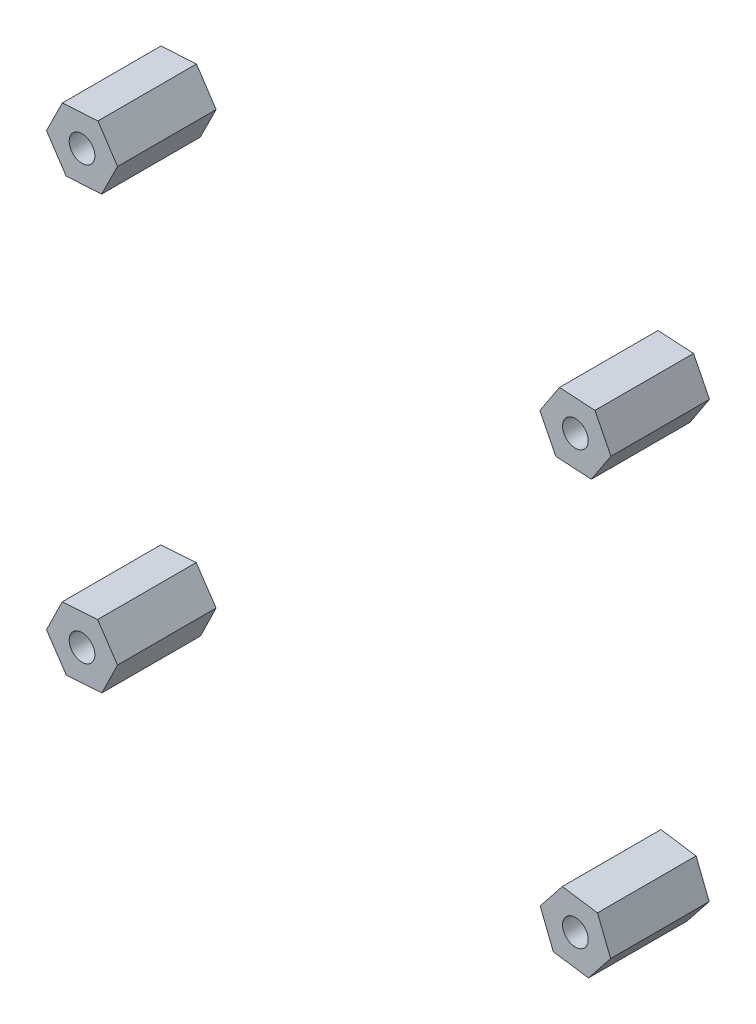
from build123d import *

# Parameters (mm, degrees)
SKETCH1_R             = 1.25
BOSS_EXTRUDE1_DEPTH   = 9.6
BOSS_EXTRUDE1_2_DEPTH = 9.6
BOSS_EXTRUDE1_3_DEPTH = 9.6
BOSS_EXTRUDE1_4_DEPTH = 9.6


with BuildPart() as part:
    # Sketch1 → Boss-Extrude1 (new body)
    with BuildSketch(Plane.XY):
        Polygon((-204.773374991, 103.579956463), (-203.227897726, 106.680198392), (-205.140047362, 109.56874193), (-208.597674263, 109.357043538), (-210.143151529, 106.256801608), (-208.231001893, 103.368258071), align=None)
        with Locations((-206.685524627, 106.4685)):
            Circle(SKETCH1_R, mode=Mode.SUBTRACT)
    extrude(amount=BOSS_EXTRUDE1_DEPTH)


with BuildPart() as body_2:
    # Sketch1 → Boss-Extrude1 2 (new body)
    with BuildSketch(Plane.XY):
        Polygon((-157.093384884, 103.371588278), (-155.187450531, 106.264236587), (-156.739590274, 109.36114831), (-160.197664371, 109.565411723), (-162.103598724, 106.672763414), (-160.551458981, 103.575851691), align=None)
        with Locations((-158.645524627, 106.4685)):
            Circle(SKETCH1_R, mode=Mode.SUBTRACT)
    extrude(amount=BOSS_EXTRUDE1_2_DEPTH)


with BuildPart() as body_3:
    # Sketch1 → Boss-Extrude1 3 (new body)
    with BuildSketch(Plane.XY):
        Polygon((-204.748368835, 61.526666538), (-203.229865997, 64.640209397), (-205.16702179, 67.512042859), (-208.62268042, 67.270333463), (-210.141183257, 64.156790604), (-208.204027465, 61.284957142), align=None)
        with Locations((-206.685524627, 64.3985)):
            Circle(SKETCH1_R, mode=Mode.SUBTRACT)
    extrude(amount=BOSS_EXTRUDE1_3_DEPTH)


with BuildPart() as body_4:
    # Sketch1 → Boss-Extrude1 4 (new body)
    with BuildSketch(Plane.XY):
        Polygon((-157.372499469, 61.176791301), (-155.21893047, 63.890117777), (-156.491955629, 67.111826477), (-159.918549785, 67.6202087), (-162.072118784, 64.906882224), (-160.799093626, 61.685173524), align=None)
        with Locations((-158.645524627, 64.3985)):
            Circle(SKETCH1_R, mode=Mode.SUBTRACT)
    extrude(amount=BOSS_EXTRUDE1_4_DEPTH)


solid = Compound([part.part, body_2.part, body_3.part, body_4.part])
